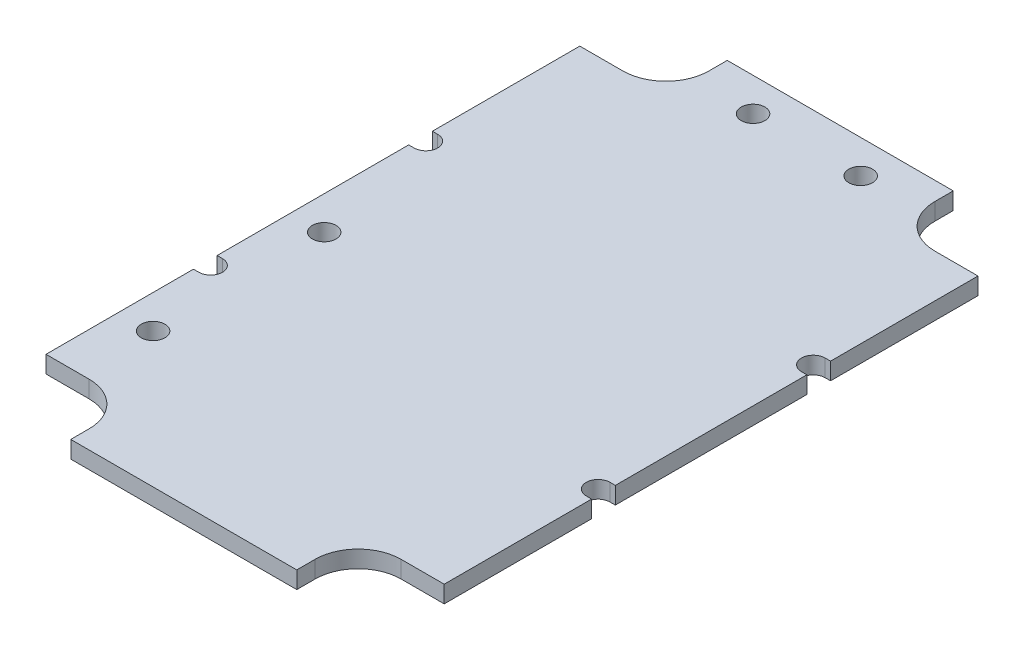
from build123d import *

# Parameters (mm, degrees)
SKETCH1_W                                   = 37
SKETCH1_H                                   = 61
BASE_EXTRUSION_DEPTH                        = 1.5875
M2_CLEARANCE_HOLE3_D                        = 2.2
SKETCH8_W                                   = 0.5
SKETCH8_H                                   = 2.2
SIDE_SLOTS_DEPTH                            = 36.707424386
CORNER_BOSS_CLEARANCE_DEPTH                 = 36.707424386
CORNER_BOSS_CLEARANCE_MIRROR_2_COPY_1_DEPTH = 36.707424386
SKETCH10_R                                  = 1.1
AC_WIRE_HOLES_DEPTH                         = 36.707424386


with BuildPart() as part:
    # Sketch1 → Base Extrusion (new body)
    with BuildSketch(Plane(origin=(0, 0, 0), x_dir=(1, 0, 0), z_dir=(0, 1, 0))):
        Rectangle(SKETCH1_W, SKETCH1_H)
    extrude(amount=BASE_EXTRUSION_DEPTH)

    # M2 Clearance Hole3 (through all)
    with Locations(Plane(origin=(0, 1.5875, 0), x_dir=(1, 0, 0), z_dir=(0, 1, 0))):
        with Locations((-18, 10), (-18, -10), (18, -10), (18, 10)):
            Hole(M2_CLEARANCE_HOLE3_D / 2)

    # Sketch8 → Side Slots (cut, through all)
    with BuildSketch(Plane(origin=(0, 1.5875, 0), x_dir=(1, 0, 0), z_dir=(0, 1, 0))):
        with Locations((-18.25, 10)):
            Rectangle(SKETCH8_W, SKETCH8_H)
        with Locations((-18.25, -10)):
            Rectangle(SKETCH8_W, SKETCH8_H)
        with Locations((18.25, 10)):
            Rectangle(SKETCH8_W, SKETCH8_H)
        with Locations((18.25, -10)):
            Rectangle(SKETCH8_W, SKETCH8_H)
    extrude(amount=-SIDE_SLOTS_DEPTH, mode=Mode.SUBTRACT)

    # Sketch9 → Corner Boss Clearance (cut, through all)
    with BuildSketch(Plane(origin=(0, 1.5875, 0), x_dir=(1, 0, 0), z_dir=(0, 1, 0))):
        with BuildLine():
            Line((-18.5, -32.8), (-10.5, -32.8))
            Line((-10.5, -32.8), (-10.5, -28.8))
            ThreePointArc((-10.5, -28.8), (-11.671572875, -25.971572875), (-14.5, -24.8))
            Line((-14.5, -24.8), (-18.5, -24.8))
            Line((-18.5, -24.8), (-18.5, -32.8))
        make_face()
    corner_boss_clearance = extrude(amount=-CORNER_BOSS_CLEARANCE_DEPTH, mode=Mode.SUBTRACT)

    # Corner Boss Clearance Mirror: Corner Boss Clearance across plane
    add(corner_boss_clearance.mirror(Plane(origin=(0, 0, 0), x_dir=(0, 0, 1), z_dir=(1, 0, 0))), mode=Mode.SUBTRACT)

    # Corner Boss Clearance Mirror 2: Corner Boss Clearance across plane
    add(corner_boss_clearance.mirror(Plane.XY), mode=Mode.SUBTRACT)

    # Corner Boss Clearance Mirror 2 copy 1 sk → Corner Boss Clearance Mirror 2 copy 1 (cut, through all)
    with BuildSketch(Plane(origin=(0, 1.5875, 0), x_dir=(-1, 0, 0), z_dir=(0, 1, 0))):
        with BuildLine():
            Line((-18.5, -32.8), (-10.5, -32.8))
            Line((-10.5, -32.8), (-10.5, -28.8))
            ThreePointArc((-10.5, -28.8), (-11.671572875, -25.971572875), (-14.5, -24.8))
            Line((-14.5, -24.8), (-18.5, -24.8))
            Line((-18.5, -24.8), (-18.5, -32.8))
        make_face()
    extrude(amount=-CORNER_BOSS_CLEARANCE_MIRROR_2_COPY_1_DEPTH, mode=Mode.SUBTRACT)

    # Sketch10 → AC Wire Holes (cut, through all)
    with BuildSketch(Plane.XZ):
        with Locations(Location((-5, -27.4, 0), (0, 0, 270))):
            Circle(SKETCH10_R)
        with Locations(Location((5, -27.4, 0), (0, 0, 270))):
            Circle(SKETCH10_R)
        with Locations(Location((-15.4, 17.95, 0), (0, 0, 270))):
            Circle(SKETCH10_R)
        with Locations(Location((-15.4, 2.05, 0), (0, 0, 270))):
            Circle(SKETCH10_R)
    extrude(amount=-AC_WIRE_HOLES_DEPTH, mode=Mode.SUBTRACT)


solid = part.part
